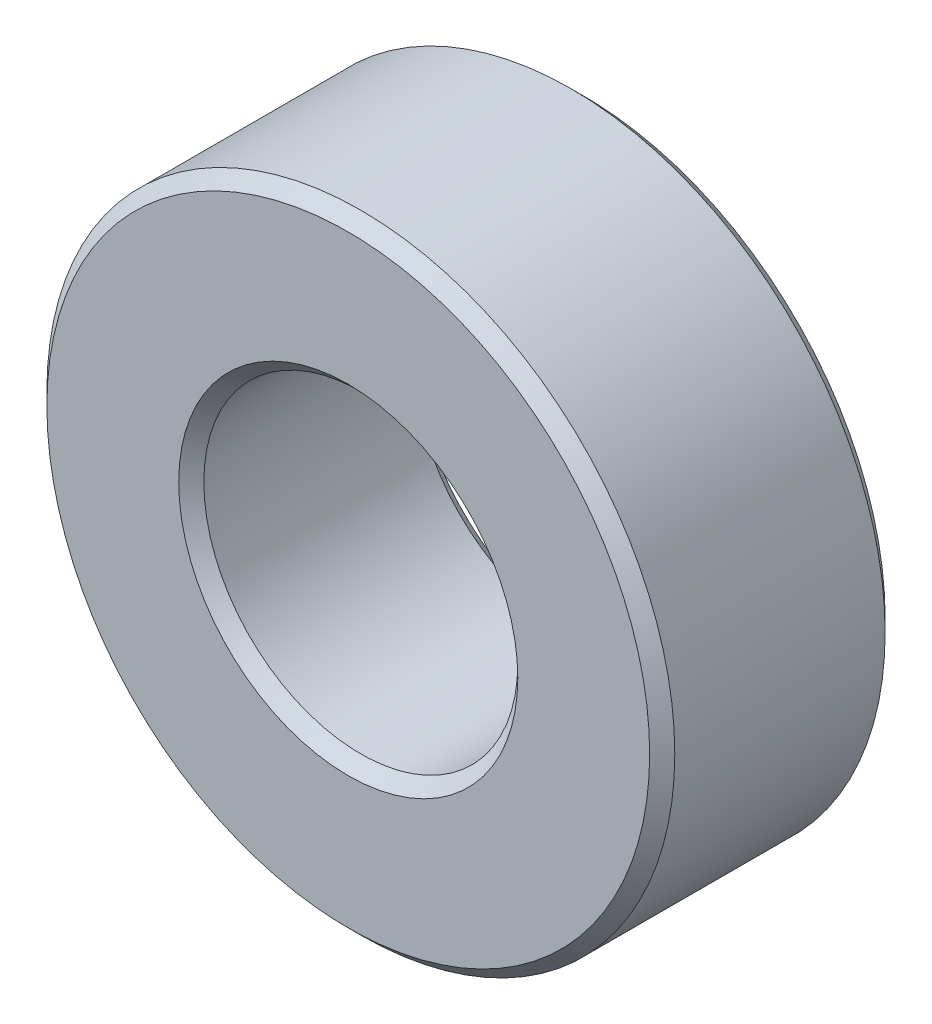
from build123d import *

# Parameters (mm, degrees)
SKETCH1_R           = 6.35
SKETCH1_R_2         = 3.175
BOSS_EXTRUDE1_DEPTH = 4.7625
CHAMFER1_SIZE       = 0.254


with BuildPart() as part:
    # Sketch1 → Boss-Extrude1 (new body)
    with BuildSketch(Plane.XY):
        with Locations(Location((0, 0, 0), (0, 0, 180))):
            Circle(SKETCH1_R)
        with Locations(Location((0, 0, 0), (0, 0, 180))):
            Circle(SKETCH1_R_2, mode=Mode.SUBTRACT)
    extrude(amount=BOSS_EXTRUDE1_DEPTH)

    # Chamfer1
    chamfer1_edges = [part.edges().sort_by_distance(p)[0] for p in [
        (6.35, 0, 0),
        (6.35, 0, 4.7625),
        (3.175, 0, 0),
        (3.175, 0, 4.7625),
    ]]
    chamfer(chamfer1_edges, length=CHAMFER1_SIZE)


solid = part.part
